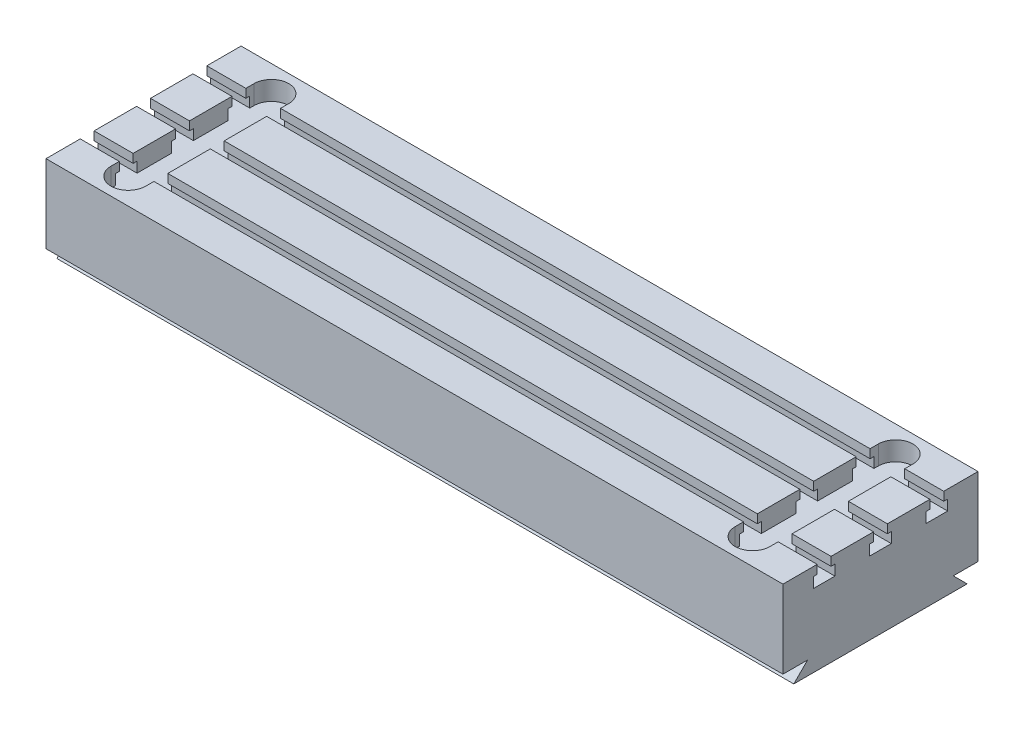
from build123d import *

# Parameters (mm, degrees)
BOSS_EXTRUDE1_DEPTH = 425
CUT_EXTRUDE1_DEPTH  = 22


with BuildPart() as part:
    # Sketch1 → Boss-Extrude1 (new, symmetric)
    with BuildSketch(Plane(origin=(0, 0, 0), x_dir=(0, 0, -1), z_dir=(1, 0, 0))):
        Polygon((-84, -90), (-100, -106), (100, -106), (84, -90), (112.5, -90), (112.5, 0), (73, 0), (73, -10), (77.5, -10), (77.5, -22), (52.5, -22), (52.5, -10), (57, -10), (57, 0), (8, 0), (8, -10), (12.5, -10), (12.5, -22), (-12.5, -22), (-12.5, -10), (-8, -10), (-8, 0), (-57, 0), (-57, -10), (-52.5, -10), (-52.5, -22), (-77.5, -22), (-77.5, -10), (-73, -10), (-73, 0), (-112.5, 0), (-112.5, -90), align=None)
    extrude(amount=BOSS_EXTRUDE1_DEPTH, both=True)

    # Sketch2 → Cut-Extrude1 (cut)
    with BuildSketch(Plane(origin=(0, 0, 0), x_dir=(1, 0, 0), z_dir=(0, 1, 0))):
        with BuildLine():
            Line((340, -82.5), (340, 82.5))
            ThreePointArc((340, 82.5), (360, 102.5), (380, 82.5))
            Line((380, 82.5), (380, -82.5))
            ThreePointArc((380, -82.5), (360, -102.5), (340, -82.5))
        make_face()
        with BuildLine():
            Line((-380, 82.5), (-380, -82.5))
            ThreePointArc((-380, -82.5), (-360, -102.5), (-340, -82.5))
            Line((-340, -82.5), (-340, 82.5))
            ThreePointArc((-340, 82.5), (-360, 102.5), (-380, 82.5))
        make_face()
    extrude(amount=-CUT_EXTRUDE1_DEPTH, mode=Mode.SUBTRACT)


solid = part.part
